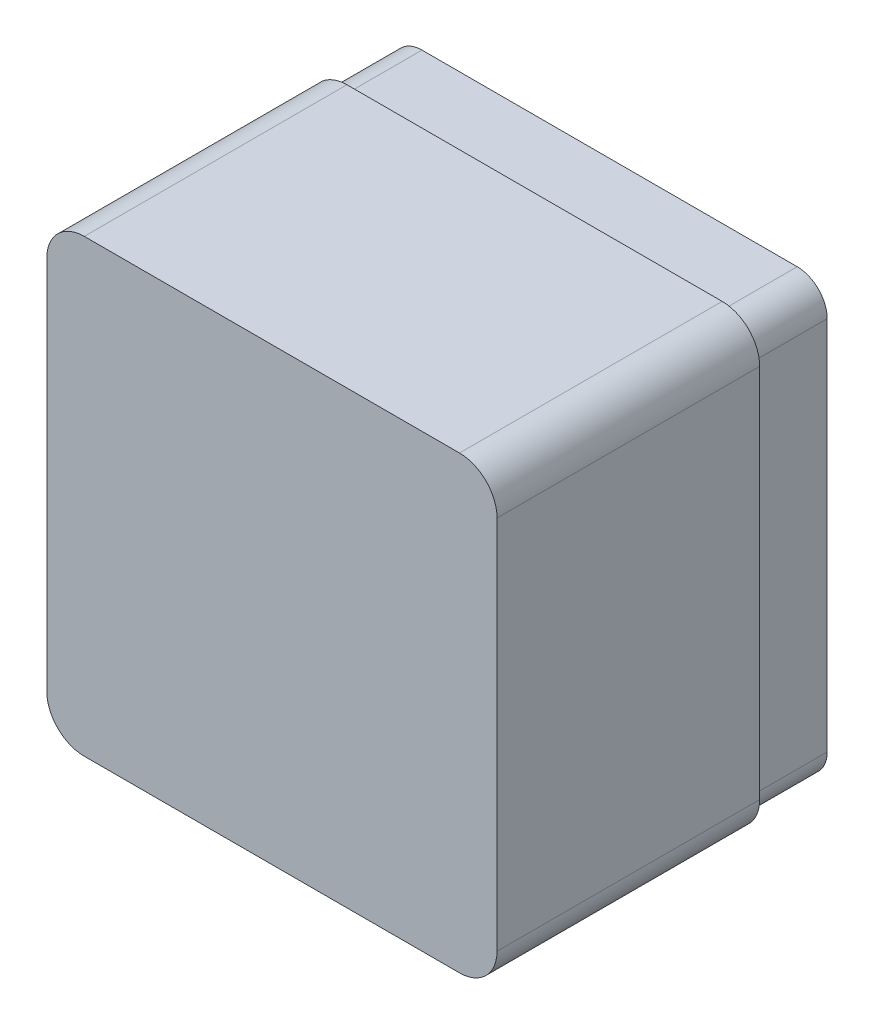
from build123d import *

# Parameters (mm, degrees)
SKETCH1_W           = 120
SKETCH1_H           = 120
BOSS_EXTRUDE1_DEPTH = 90
FILLET1_R           = 10
SHELL1_T            = -4
SKETCH6_OUTSIDE_W   = 160.418
SKETCH6_OUTSIDE_H   = 160.418
CUT_EXTRUDE5_DEPTH  = 20


with BuildPart() as part:
    # Sketch1 → Boss-Extrude1 (new body)
    with BuildSketch(Plane.XY):
        Rectangle(SKETCH1_W, SKETCH1_H)
    extrude(amount=BOSS_EXTRUDE1_DEPTH)

    # Fillet1
    fillet1_edges = [part.edges().sort_by_distance(p)[0] for p in [
        (60, -60, 45),
        (-60, -60, 45),
        (-60, 60, 45),
        (60, 60, 45),
    ]]
    fillet(fillet1_edges, radius=FILLET1_R)

    # Shell1
    shell1_openings = [part.faces().sort_by_distance(p)[0] for p in [
        (0, 0, 0),
    ]]
    offset(amount=SHELL1_T, openings=shell1_openings, kind=Kind.INTERSECTION)

    # Sketch6 outside → Cut-Extrude5 (cut)
    with BuildSketch(Plane(origin=(0, 0, 0), x_dir=(-1, 0, 0), z_dir=(0, 0, -1))):
        Rectangle(SKETCH6_OUTSIDE_W, SKETCH6_OUTSIDE_H)
        with BuildLine():
            Line((58, -50), (58, 50))
            ThreePointArc((58, 50), (55.656854249, 55.656854249), (50, 58))
            Line((50, 58), (-50, 58))
            ThreePointArc((-50, 58), (-55.656854249, 55.656854249), (-58, 50))
            Line((-58, 50), (-58, -50))
            ThreePointArc((-58, -50), (-55.656854249, -55.656854249), (-50, -58))
            Line((-50, -58), (50, -58))
            ThreePointArc((50, -58), (55.656854249, -55.656854249), (58, -50))
        make_face(mode=Mode.SUBTRACT)
    extrude(amount=-CUT_EXTRUDE5_DEPTH, mode=Mode.SUBTRACT)


solid = part.part
